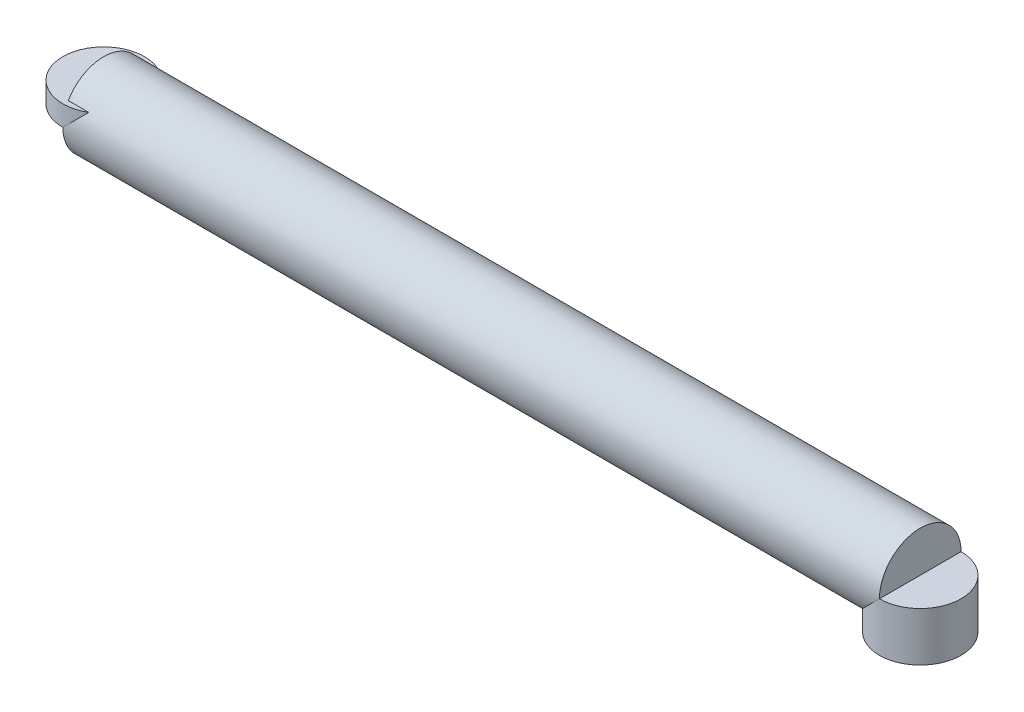
from build123d import *

# Parameters (mm, degrees)
SKETCH1_R           = 1
BOSS_EXTRUDE1_DEPTH = 1.2
SKETCH2_R           = 1
BOSS_EXTRUDE2_DEPTH = 20
SKETCH3_R           = 1
BOSS_EXTRUDE3_DEPTH = 0.5


with BuildPart() as part:
    # Sketch1 → Boss-Extrude1 (new body)
    with BuildSketch(Plane(origin=(0, 71.8, 0), x_dir=(1, 0, 0), z_dir=(0, 1, 0))):
        with Locations(Location((24, -16.7, 0), (0, 0, 270))):
            Circle(SKETCH1_R)
    extrude(amount=BOSS_EXTRUDE1_DEPTH)

    # Sketch2 → Boss-Extrude2 (add)
    with BuildSketch(Plane(origin=(4, 0, 0), x_dir=(0, 0, -1), z_dir=(1, 0, 0))):
        with Locations((-16.7, 73)):
            Circle(SKETCH2_R)
    extrude(amount=BOSS_EXTRUDE2_DEPTH)

    # Sketch3 → Boss-Extrude3 (add)
    with BuildSketch(Plane(origin=(0, 73, 0), x_dir=(1, 0, 0), z_dir=(0, 1, 0))):
        with Locations((4, -16.7)):
            Circle(SKETCH3_R)
    extrude(amount=BOSS_EXTRUDE3_DEPTH)


solid = part.part
